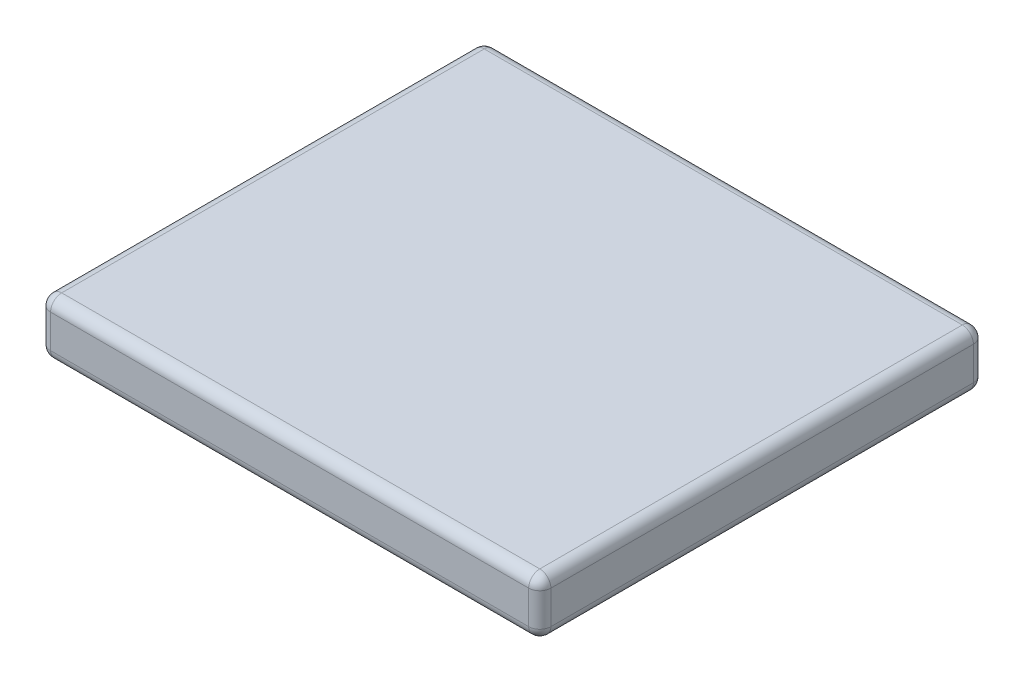
from build123d import *

# Parameters (mm, degrees)
SKETCH1_W           = 90
SKETCH1_H           = 10
BOSS_EXTRUDE1_DEPTH = 80
FILLET1_R           = 2


with BuildPart() as part:
    # Sketch1 → Boss-Extrude1 (new body)
    with BuildSketch(Plane.XY):
        Rectangle(SKETCH1_W, SKETCH1_H)
    extrude(amount=BOSS_EXTRUDE1_DEPTH)

    # Fillet1
    fillet1_edges = [part.edges().sort_by_distance(p)[0] for p in [
        (-45, 0, 80),
        (0, -5, 80),
        (45, 0, 80),
        (0, -5, 0),
        (-45, 0, 0),
        (0, 5, 0),
        (45, 0, 0),
        (45, -5, 40),
        (-45, -5, 40),
        (-45, 5, 40),
        (45, 5, 40),
        (0, 5, 80),
    ]]
    fillet(fillet1_edges, radius=FILLET1_R)


solid = part.part
